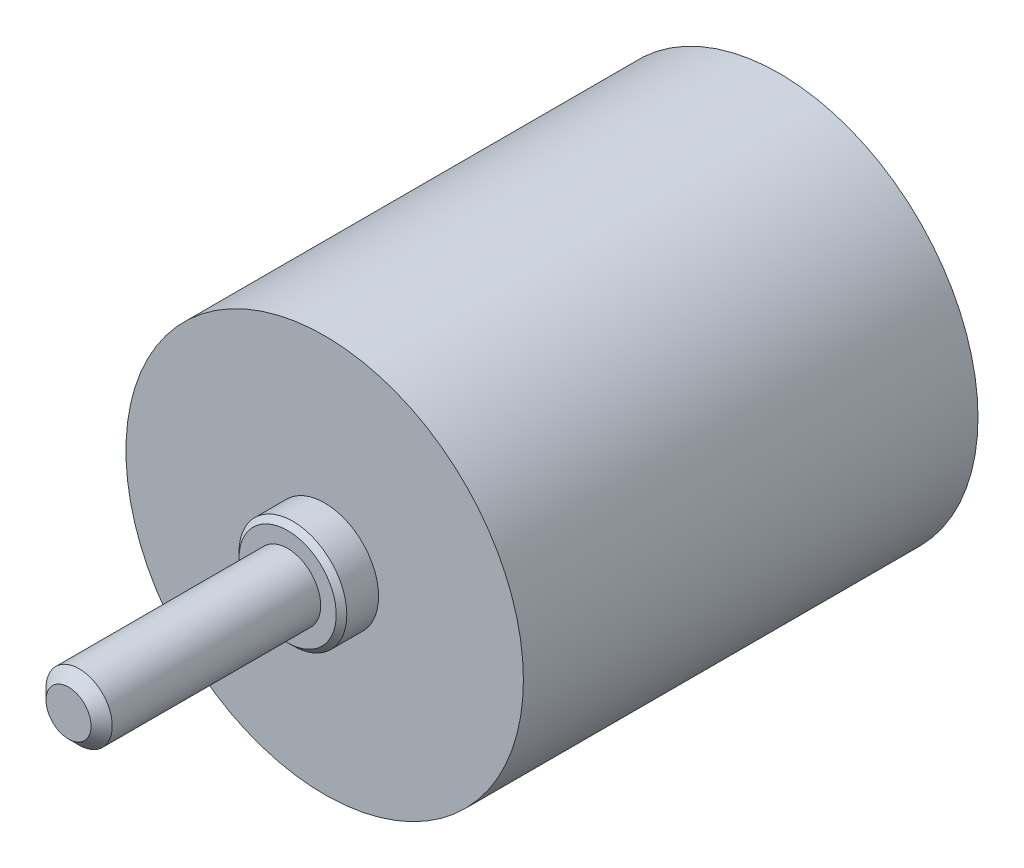
from build123d import *

# Parameters (mm, degrees)
CHAMFER1_SIZE = 1.016
CHAMFER2_SIZE = 0.508


with BuildPart() as part:
    # Sketch1 → Revolve1 (revolve)
    with BuildSketch(Plane(origin=(0, 0, 0), x_dir=(0, 0, -1), z_dir=(1, 0, 0)), mode=Mode.PRIVATE) as revolve1_sk:
        Polygon((0, 0), (0, 3.175), (21, 3.175), (21, 5.1689), (24.556, 5.1689), (24.556, 19.05), (68.134749365, 19.05), (68.134749365, 5.1689), (72.7964, 5.1689), (72.7964, 0), align=None)
    revolve(revolve1_sk.sketch.rotate(Axis((0, 0, 0), (0, 0, -1)), 90), axis=Axis((0, 0, 0), (0, 0, -1)))

    # Chamfer1
    chamfer1_edges = [part.edges().sort_by_distance(p)[0] for p in [
        (-3.175, 0, 0),
    ]]
    chamfer(chamfer1_edges, length=CHAMFER1_SIZE)

    # Chamfer2
    chamfer2_edges = [part.edges().sort_by_distance(p)[0] for p in [
        (-5.1689, 0, -72.7964),
        (-5.1689, 0, -21),
    ]]
    chamfer(chamfer2_edges, length=CHAMFER2_SIZE)


solid = part.part
